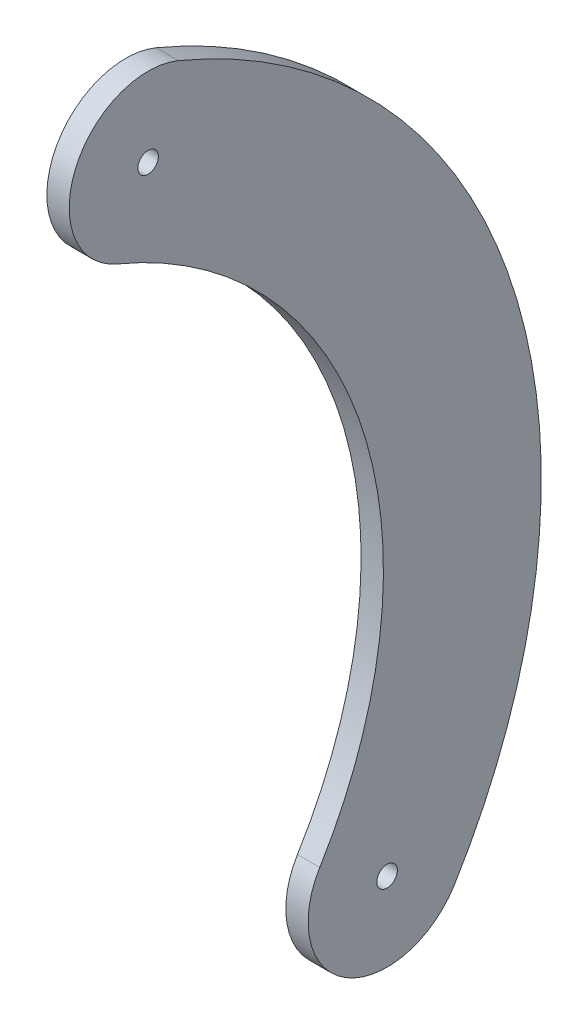
from build123d import *

# Parameters (mm, degrees)
SKETCH1_R           = 2.6067
BOSS_EXTRUDE1_DEPTH = 5.661


with BuildPart() as part:
    # Sketch1 → Boss-Extrude1 (new body)
    with BuildSketch(Plane(origin=(0, 0, 0), x_dir=(0, 0, -1), z_dir=(1, 0, 0))):
        with BuildLine():
            ThreePointArc((47.322565062, -103.92661132), (62.088183898, 20.109978147), (-22.594009606, 111.936037246))
            ThreePointArc((-22.594009606, 111.936037246), (-48.740767362, 101.149607863), (-37.954337979, 75.002850107))
            ThreePointArc((-37.954337979, 75.002850107), (24.03446637, 7.784614771), (13.225782523, -83.012276033))
            ThreePointArc((13.225782523, -83.012276033), (19.817006149, -110.517834946), (47.322565062, -103.92661132))
        make_face()
        with Locations((-30.274173793, 93.469443676)):
            Circle(SKETCH1_R, mode=Mode.SUBTRACT)
        with Locations((30.274173793, -93.469443676)):
            Circle(SKETCH1_R, mode=Mode.SUBTRACT)
    extrude(amount=BOSS_EXTRUDE1_DEPTH)


solid = part.part
